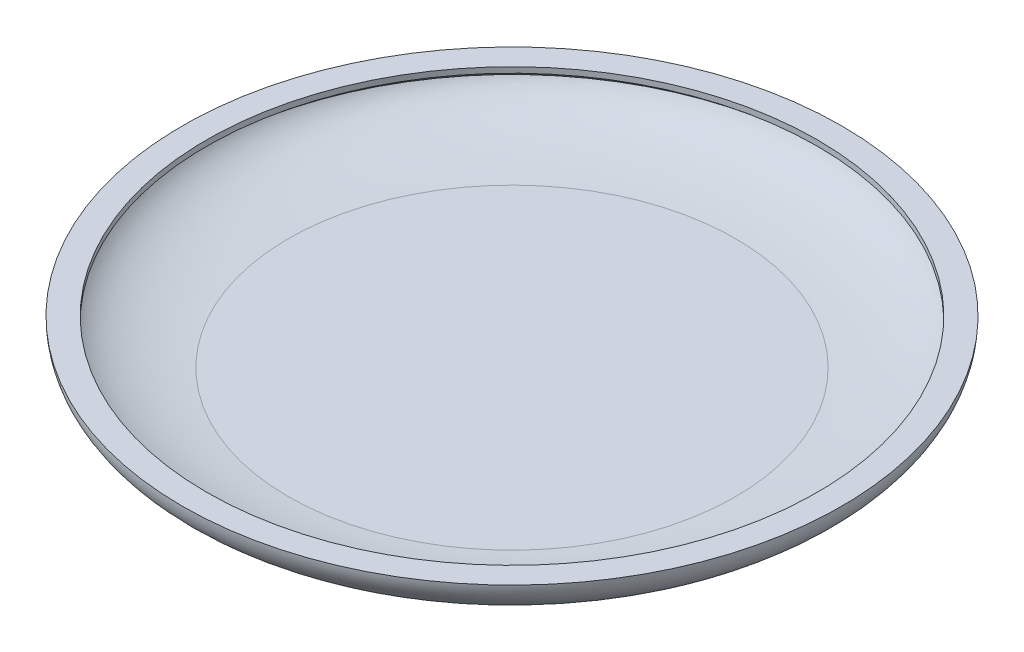
from build123d import *


with BuildPart() as part:
    # Body outline → Revolve body (revolve)
    with BuildSketch(Plane.XY, mode=Mode.PRIVATE) as revolve_body_sk:
        with BuildLine():
            Line((0, 0), (-59.811708017, 0))
            add(Edge.make_bspline(
                [(-59.811708017, 0), (-68.314971094, -0.00524792), (-88.000853814, 2.645087994), (-88.45, 14)],
                knots=[0, 0, 0, 0, 1, 1, 1, 1], degree=3))
            Line((-88.45, 14), (-81.95, 14))
            Line((-81.95, 14), (-81.95, 12.5))
            Line((-81.95, 12.5), (-84.271369309, 10.551667907))
            add(Edge.make_bspline(
                [(-60, 2), (-80.473170938, 3.42035668), (-84.271369309, 10.551667907)],
                knots=[0, 0, 0, 1, 1, 1], degree=2))
            Line((-60, 2), (0, 2))
            Line((0, 2), (0, 0))
        make_face()
    revolve(revolve_body_sk.sketch.rotate(Axis((0, 26.643087833, 0), (0, -1, 0)), 270), axis=Axis((0, 26.643087833, 0), (0, -1, 0)))


solid = part.part
